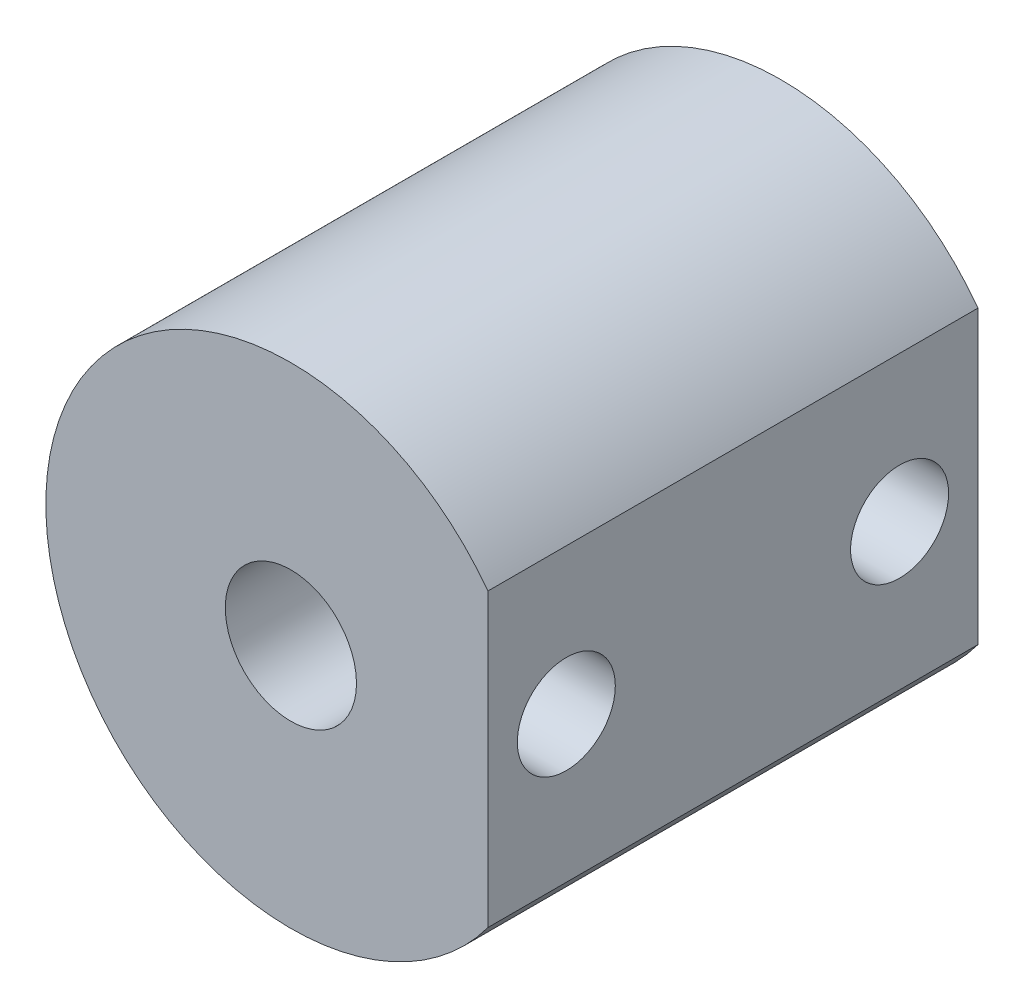
from build123d import *

# Parameters (mm, degrees)
SKETCH1_R           = 6.35
BOSS_EXTRUDE1_DEPTH = 12.7
SKETCH2_R           = 1.7
CUT_EXTRUDE1_DEPTH  = 6.35
CUT_EXTRUDE2_DEPTH  = 6.35
SKETCH4_W           = 3.114007597
SKETCH4_H           = 7.898709862
CUT_EXTRUDE3_DEPTH  = 14.224
SKETCH5_R           = 1.27
CUT_EXTRUDE4_DEPTH  = 3.81


with BuildPart() as part:
    # Sketch1 → Boss-Extrude1 (new body)
    with BuildSketch(Plane.XY):
        Circle(SKETCH1_R)
    extrude(amount=BOSS_EXTRUDE1_DEPTH)

    # Sketch2 → Cut-Extrude1 (cut)
    with BuildSketch(Plane.XY.offset(12.7)):
        Circle(SKETCH2_R)
    extrude(amount=-CUT_EXTRUDE1_DEPTH, mode=Mode.SUBTRACT)

    # Sketch3 → Cut-Extrude2 (cut)
    with BuildSketch(Plane(origin=(0, 0, 0), x_dir=(-1, 0, 0), z_dir=(0, 0, -1))):
        Polygon((-2.546359249, -1.478531177), (0.007265935, -2.944477385), (2.553625184, -1.465946208), (2.546359249, 1.478531177), (-0.007265935, 2.944477385), (-2.553625184, 1.465946208), align=None)
    extrude(amount=-CUT_EXTRUDE2_DEPTH, mode=Mode.SUBTRACT)

    # Sketch4 → Cut-Extrude3 (cut)
    with BuildSketch(Plane(origin=(0, 0, 0), x_dir=(-1, 0, 0), z_dir=(0, 0, -1))):
        with Locations((-6.6621984, 0.173181196)):
            Rectangle(SKETCH4_W, SKETCH4_H)
    extrude(amount=-CUT_EXTRUDE3_DEPTH, mode=Mode.SUBTRACT)

    # Sketch5 → Cut-Extrude4 (cut)
    with BuildSketch(Plane(origin=(5.105194602, 0, 0), x_dir=(0, 0, -1), z_dir=(1, 0, 0))):
        with Locations((-10.668, 0)):
            Circle(SKETCH5_R)
        with Locations((-2.032, 0)):
            Circle(SKETCH5_R)
    extrude(amount=-CUT_EXTRUDE4_DEPTH, mode=Mode.SUBTRACT)


solid = part.part
